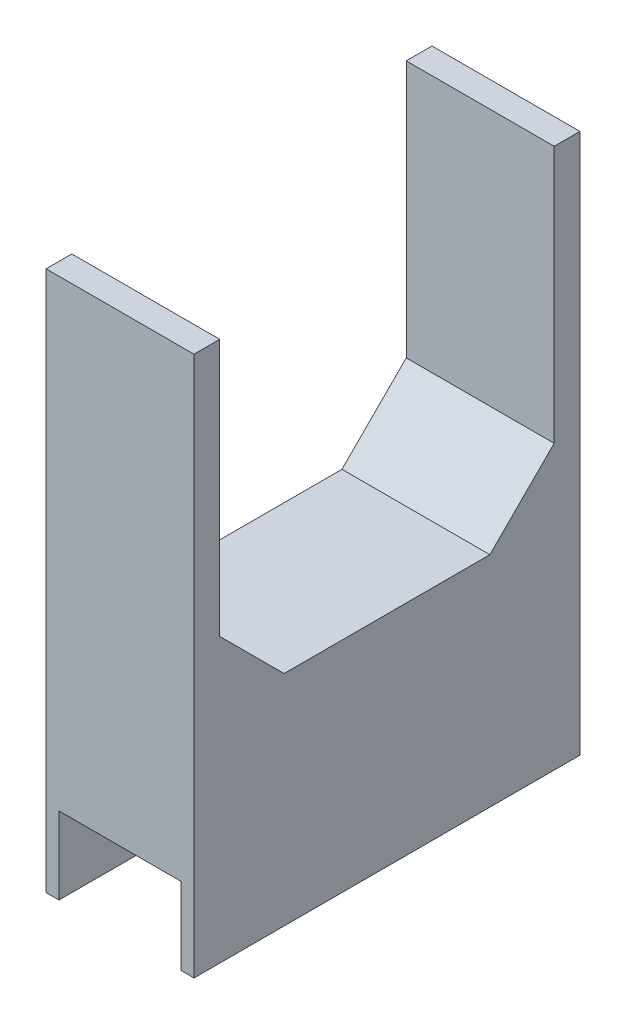
from build123d import *

# Parameters (mm, degrees)
SKETCH1_W           = 11.5
SKETCH1_H           = 30
BOSS_EXTRUDE1_DEPTH = 11
SKETCH3_W           = 11.5
SKETCH3_H           = 30
BOSS_EXTRUDE3_DEPTH = 6
SKETCH4_W           = 9.5
SKETCH4_H           = 6
CUT_EXTRUDE1_DEPTH  = 33.466328711
SKETCH7_W           = 2
SKETCH7_H           = 6
CUT_EXTRUDE2_DEPTH  = 10
SKETCH8_W           = 11.5
SKETCH8_H           = 30
BOSS_EXTRUDE4_DEPTH = 25
SKETCH9_W           = 26
SKETCH9_H           = 25
CUT_EXTRUDE3_DEPTH  = 41.660177078
CHAMFER1_SIZE       = 5


with BuildPart() as part:
    # Sketch1 → Boss-Extrude1 (new body)
    with BuildSketch(Plane(origin=(0, 0, 0), x_dir=(1, 0, 0), z_dir=(0, 1, 0))):
        Rectangle(SKETCH1_W, SKETCH1_H)
    extrude(amount=BOSS_EXTRUDE1_DEPTH)

    # Sketch3 → Boss-Extrude3 (add)
    with BuildSketch(Plane.XZ):
        Rectangle(SKETCH3_W, SKETCH3_H)
    extrude(amount=BOSS_EXTRUDE3_DEPTH)

    # Sketch4 → Cut-Extrude1 (cut, through all)
    with BuildSketch(Plane.XY.offset(15)):
        with Locations((0, -3)):
            Rectangle(SKETCH4_W, SKETCH4_H)
    extrude(amount=-CUT_EXTRUDE1_DEPTH, mode=Mode.SUBTRACT)

    # Sketch7 → Cut-Extrude2 (cut)
    with BuildSketch(Plane.XZ):
        Rectangle(SKETCH7_W, SKETCH7_H)
    extrude(amount=-CUT_EXTRUDE2_DEPTH, mode=Mode.SUBTRACT)

    # Sketch8 → Boss-Extrude4 (add)
    with BuildSketch(Plane(origin=(0, 11, 0), x_dir=(1, 0, 0), z_dir=(0, 1, 0))):
        Rectangle(SKETCH8_W, SKETCH8_H)
    extrude(amount=BOSS_EXTRUDE4_DEPTH)

    # Sketch9 → Cut-Extrude3 (cut, through all)
    with BuildSketch(Plane.ZY.offset(5.75)):
        with Locations((0, 23.5)):
            Rectangle(SKETCH9_W, SKETCH9_H)
    extrude(amount=-CUT_EXTRUDE3_DEPTH, mode=Mode.SUBTRACT)

    # Chamfer1
    chamfer1_edges = [part.edges().sort_by_distance(p)[0] for p in [
        (0, 11, -13),
        (0, 11, 13),
    ]]
    chamfer(chamfer1_edges, length=CHAMFER1_SIZE)


solid = part.part
